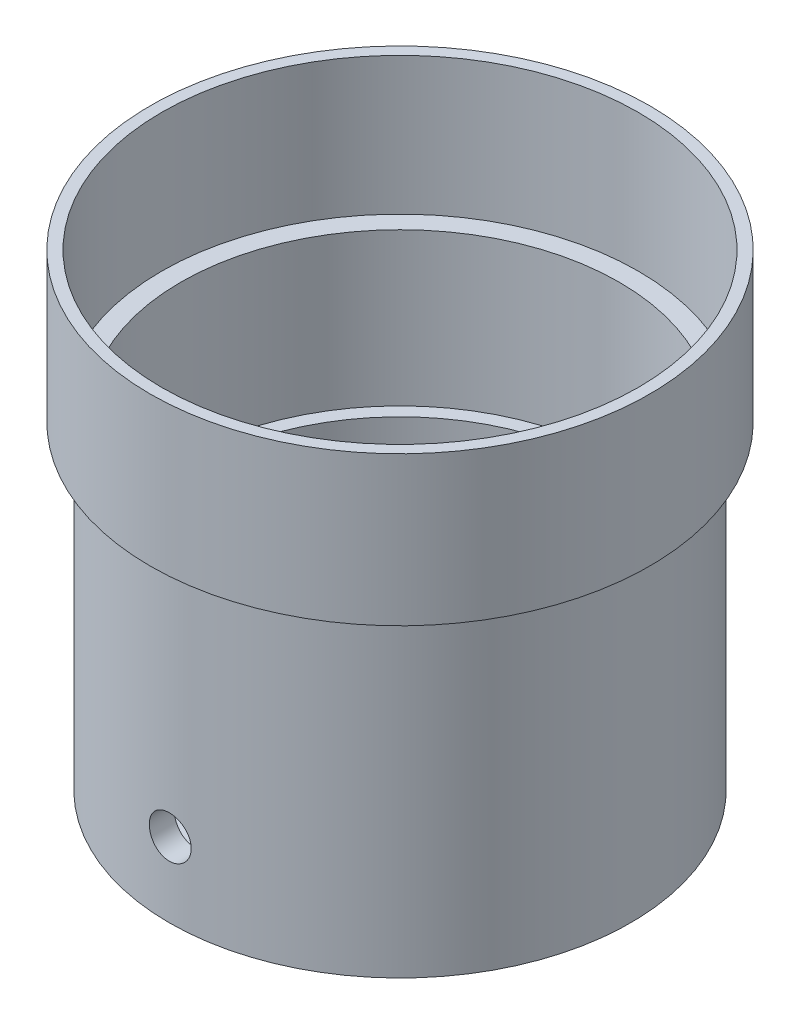
from build123d import *

# Parameters (mm, degrees)
BOSS_EXTRUDE1_START     = 4
SKETCH3_R               = 60.475
BOSS_EXTRUDE1_DEPTH     = 4
CUT_EXTRUDE1_DEPTH      = 151.434121296
CUT_EXTRUDE1_DEPTH_BACK = 4
SKETCH5_R               = 5.5


with BuildPart() as part:
    # Sketch1 → Revolve1 (revolve)
    with BuildSketch(Plane.XY, mode=Mode.PRIVATE) as revolve1_sk:
        Polygon((53.975, 0), (53.975, 42.5), (57.475, 42.5), (57.475, 82.5), (62.475, 82.5), (62.475, 118.56), (65.475, 118.56), (65.475, 79.5), (60.475, 79.5), (60.475, 0), align=None)
    revolve(revolve1_sk.sketch.rotate(Axis((0, 0, 0), (0, 1, 0)), 90), axis=Axis((0, 0, 0), (0, 1, 0)))

    # Sketch3 → Boss-Extrude1 (add)
    with BuildSketch(Plane.XZ.offset(BOSS_EXTRUDE1_START)):
        with Locations(Location((0, 0, 0), (0, 0, 270))):
            Circle(SKETCH3_R)
    extrude(amount=-BOSS_EXTRUDE1_DEPTH)

    # Sketch5 → Cut-Extrude1 (cut, two sides: drawn at the far end of the back side and taken through both)
    with BuildSketch(Plane.XY.offset(-CUT_EXTRUDE1_DEPTH_BACK)):
        with Locations(Location((0, 15.5, 0), (0, 0, 180))):
            Circle(SKETCH5_R)
    extrude(amount=CUT_EXTRUDE1_DEPTH + CUT_EXTRUDE1_DEPTH_BACK, mode=Mode.SUBTRACT)


solid = part.part
